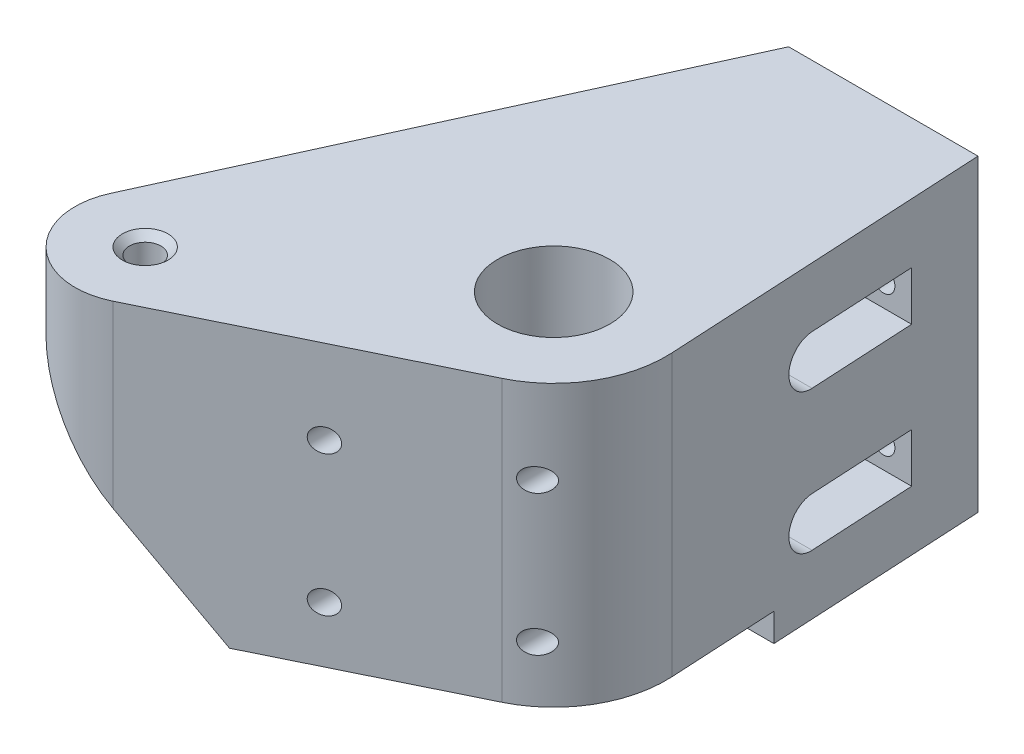
from build123d import *

# Parameters (mm, degrees)
SKETCH1_R                      = 8
SKETCH1_R_2                    = 2.25
BOSS_EXTRUDE1_DEPTH            = 44
CUT_EXTRUDE4_DEPTH             = 4
CUT_EXTRUDE5_DEPTH             = 103.107700493
F_4_5_4_5_DIAMETER_HOLE1_D     = 4.5
F_4_5_4_5_DIAMETER_HOLE1_DEPTH = 10
F_4_5_4_5_DIAMETER_HOLE1_TIP   = 1.351936393
CHAMFER1_SIZE                  = 1
F_3_3_3_3_DIAMETER_HOLE1_D     = 3.3
CUT_EXTRUDE6_DEPTH             = 103.107700536
CUT_EXTRUDE6_DEPTH_BACK        = 103.107700536
CUT_EXTRUDE7_DEPTH             = 119.532622092


with BuildPart() as part:
    # Sketch1 → Boss-Extrude1 (new body)
    with BuildSketch(Plane(origin=(0, 0, 0), x_dir=(1, 0, 0), z_dir=(0, 1, 0))):
        with BuildLine():
            Line((-13.5, 0), (13.5, 0))
            Line((13.5, 0), (15.976995957, 46.142328626))
            ThreePointArc((15.976995957, 46.142328626), (13.793369664, 55.108202842), (7.021555451, 61.376987134))
            Line((7.021555451, 61.376987134), (-30.261527843, 79.585616959))
            ThreePointArc((-30.261527843, 79.585616959), (-41.624453455, 77.76637977), (-43.75141009, 66.457013833))
            Line((-43.75141009, 66.457013833), (-13.5, 0))
        make_face()
        with Locations(Location((0, 47, 0), (0, 0, 270))):
            Circle(SKETCH1_R, mode=Mode.SUBTRACT)
        with Locations(Location((-34.65, 70.6, 0), (0, 0, 270))):
            Circle(SKETCH1_R_2, mode=Mode.SUBTRACT)
    extrude(amount=BOSS_EXTRUDE1_DEPTH)

    # Sketch2 → Cut-Extrude4 (cut)
    with BuildSketch(Plane.XZ):
        Polygon((0, -30.75), (15.150710485, -30.75), (16.545133066, -56.725781169), (-44.65, -86.612781563), (-44.65, -30.75), align=None)
    extrude(amount=-CUT_EXTRUDE4_DEPTH, mode=Mode.SUBTRACT)

    # Sketch4 → Cut-Extrude5 (cut, through all)
    with BuildSketch(Plane.XY):
        Polygon((-16, 0), (-44.65, 37), (-44.65, 0), align=None)
    extrude(amount=-CUT_EXTRUDE5_DEPTH, mode=Mode.SUBTRACT)

    # Ø4.5 (4.5) Diameter Hole1
    with Locations(Plane(origin=(0, 4, 0), x_dir=(-1, 0, 0), z_dir=(0, -1, 0))):
        with Locations((0, 35), (0, 59), (12, 47), (-12, 47)):
            Hole(F_4_5_4_5_DIAMETER_HOLE1_D / 2, depth=F_4_5_4_5_DIAMETER_HOLE1_DEPTH)
            with Locations((0, 0, -(F_4_5_4_5_DIAMETER_HOLE1_DEPTH + F_4_5_4_5_DIAMETER_HOLE1_TIP / 2))):  # 118° drill point
                Cone(0, F_4_5_4_5_DIAMETER_HOLE1_D / 2, F_4_5_4_5_DIAMETER_HOLE1_TIP, mode=Mode.SUBTRACT)

    # Chamfer1
    chamfer1_edges = [part.edges().sort_by_distance(p)[0] for p in [
        (-14.25, 4, -47),
        (-2.25, 4, -59),
        (-2.25, 4, -35),
        (-34.65, 44, -72.85),
        (9.75, 4, -47),
    ]]
    chamfer(chamfer1_edges, length=CHAMFER1_SIZE)

    # Ø3.3 (3.3) Diameter Hole1 (through all)
    with Locations(Plane.XY):
        with Locations((-10, 32), (10, 32), (10, 12), (-10, 12)):
            Hole(F_3_3_3_3_DIAMETER_HOLE1_D / 2)

    # Sketch13 → Cut-Extrude6 (cut, two sides: drawn at the far end of the back side and taken through both)
    with BuildSketch(Plane(origin=(0, 0, 0), x_dir=(0, 0, -1), z_dir=(1, 0, 0)).offset(-CUT_EXTRUDE6_DEPTH_BACK)):
        with BuildLine():
            Line((10, 35.5), (25, 35.5))
            ThreePointArc((25, 35.5), (28.5, 32), (25, 28.5))
            Line((25, 28.5), (10, 28.5))
            Line((10, 28.5), (10, 35.5))
        make_face()
        with BuildLine():
            Line((10, 15.5), (25, 15.5))
            ThreePointArc((25, 15.5), (28.5, 12), (25, 8.5))
            Line((25, 8.5), (10, 8.5))
            Line((10, 8.5), (10, 15.5))
        make_face()
    extrude(amount=CUT_EXTRUDE6_DEPTH + CUT_EXTRUDE6_DEPTH_BACK, mode=Mode.SUBTRACT)


with BuildPart() as body_2:
    # Mirror2: mirrored copy
    add(part.part.mirror(Plane.XY.offset(10)))


with BuildPart() as part_1:
    add(part.part)

    # Sketch14 → Cut-Extrude7 (cut, through all)
    with BuildSketch(Plane(origin=(0, 44, 0), x_dir=(1, 0, 0), z_dir=(0, 1, 0))):
        with BuildLine():
            Line((-13.5, 0), (-43.75141009, 66.457013833))
            ThreePointArc((-43.75141009, 66.457013833), (-41.624453455, 77.76637977), (-30.261527843, 79.585616959))
            Line((-30.261527843, 79.585616959), (7.021555451, 61.376987134))
            ThreePointArc((7.021555451, 61.376987134), (13.793369664, 55.108202842), (15.976995957, 46.142328626))
            Line((15.976995957, 46.142328626), (13.5, 0))
            Line((13.5, 0), (-13.5, 0))
        make_face()
    extrude(amount=-CUT_EXTRUDE7_DEPTH, mode=Mode.SUBTRACT)


solid = body_2.part
